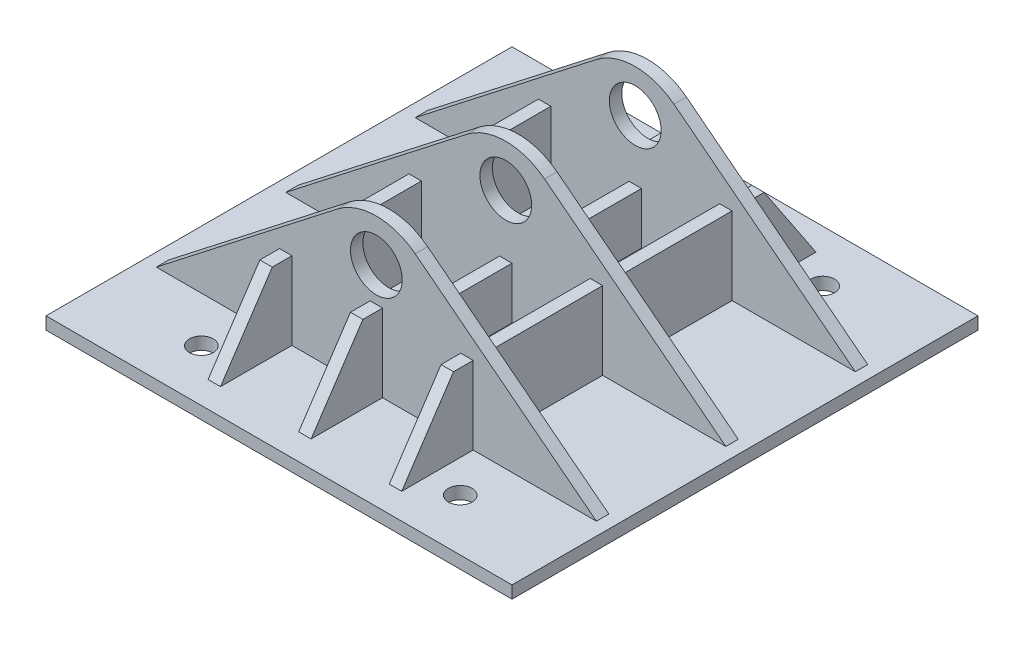
from build123d import *

# Parameters (mm, degrees)
SKETCH_1_W          = 450
SKETCH_1_H          = 450
EXTRUDE_1_DEPTH     = 12
SKETCH_2_R          = 11.5
CUT_EXTRUDE_1_DEPTH = 637.509230098
SKETCH_5_W          = 450
SKETCH_5_H          = 12
EXTRUDE_2_DEPTH     = 150
SKETCH_6_R          = 25
CUT_EXTRUDE_2_DEPTH = 597.221435374
SKETCH_7_W          = 12
SKETCH_7_H          = 75
EXTRUDE_3_DEPTH     = 450
CUT_EXTRUDE_4_DEPTH = 575.337226723
SKETCH_10_W         = 113
SKETCH_10_H         = 25
CUT_EXTRUDE_5_DEPTH = 12


with BuildPart() as part:
    # 草图1 → 凸台-拉伸1 (new body)
    with BuildSketch(Plane(origin=(0, 0, 0), x_dir=(1, 0, 0), z_dir=(0, 1, 0))):
        with Locations((225, 225)):
            Rectangle(SKETCH_1_W, SKETCH_1_H)
    extrude(amount=EXTRUDE_1_DEPTH)

    # 草图2 → 切除-拉伸1 (cut, through all)
    with BuildSketch(Plane(origin=(0, 12, 0), x_dir=(1, 0, 0), z_dir=(0, 1, 0))):
        with Locations(Location((100, 50, 0), (0, 0, 270))):
            Circle(SKETCH_2_R)
        with Locations(Location((100, 400, 0), (0, 0, 270))):
            Circle(SKETCH_2_R)
        with Locations(Location((350, 400, 0), (0, 0, 270))):
            Circle(SKETCH_2_R)
        with Locations(Location((350, 50, 0), (0, 0, 270))):
            Circle(SKETCH_2_R)
    extrude(amount=-CUT_EXTRUDE_1_DEPTH, mode=Mode.SUBTRACT)

    # 草图5 → 凸台-拉伸2 (add)
    with BuildSketch(Plane(origin=(0, 12, 0), x_dir=(1, 0, 0), z_dir=(0, 1, 0))):
        with Locations((225, 350)):
            Rectangle(SKETCH_5_W, SKETCH_5_H)
        with Locations((225, 225)):
            Rectangle(SKETCH_5_W, SKETCH_5_H)
        with Locations((225, 100)):
            Rectangle(SKETCH_5_W, SKETCH_5_H)
    extrude(amount=EXTRUDE_2_DEPTH)

    # 草图6 → 切除-拉伸2 (cut, through all)
    with BuildSketch(Plane.XY.offset(-94)):
        with Locations((225, 120)):
            Circle(SKETCH_6_R)
        with BuildLine():
            Line((0, 162), (0, 12))
            Line((0, 12), (12.5, 12))
            Line((12.5, 12), (187.5, 148.131907659))
            ThreePointArc((187.5, 148.131907659), (225, 161), (262.5, 148.131907659))
            Line((262.5, 148.131907659), (437.5, 12))
            Line((437.5, 12), (450, 12))
            Line((450, 12), (450, 162))
            Line((450, 162), (0, 162))
        make_face()
    extrude(amount=-CUT_EXTRUDE_2_DEPTH, mode=Mode.SUBTRACT)

    # 草图7 → 凸台-拉伸3 (add)
    with BuildSketch(Plane.XY):
        with Locations((225, 49.5)):
            Rectangle(SKETCH_7_W, SKETCH_7_H)
        with Locations((137.5, 49.5)):
            Rectangle(SKETCH_7_W, SKETCH_7_H)
        with Locations((312.5, 49.5)):
            Rectangle(SKETCH_7_W, SKETCH_7_H)
    extrude(amount=-EXTRUDE_3_DEPTH)

    # 草图9 → 切除-拉伸4 (cut, through all)
    with BuildSketch(Plane.ZY.offset(-131.5)):
        Polygon((-450, 87), (-375, 87), (-425, 12), (-450, 12), align=None)
        Polygon((0, 87), (-75, 87), (-25, 12), (0, 12), align=None)
    extrude(amount=-CUT_EXTRUDE_4_DEPTH, mode=Mode.SUBTRACT)

    # 草图10 → 切除-拉伸5 (cut)
    with BuildSketch(Plane(origin=(231, 0, 0), x_dir=(0, 0, -1), z_dir=(1, 0, 0))):
        with Locations((162.5, 74.5)):
            Rectangle(SKETCH_10_W, SKETCH_10_H)
        with Locations((287.5, 74.5)):
            Rectangle(SKETCH_10_W, SKETCH_10_H)
    extrude(amount=-CUT_EXTRUDE_5_DEPTH, mode=Mode.SUBTRACT)


solid = part.part
